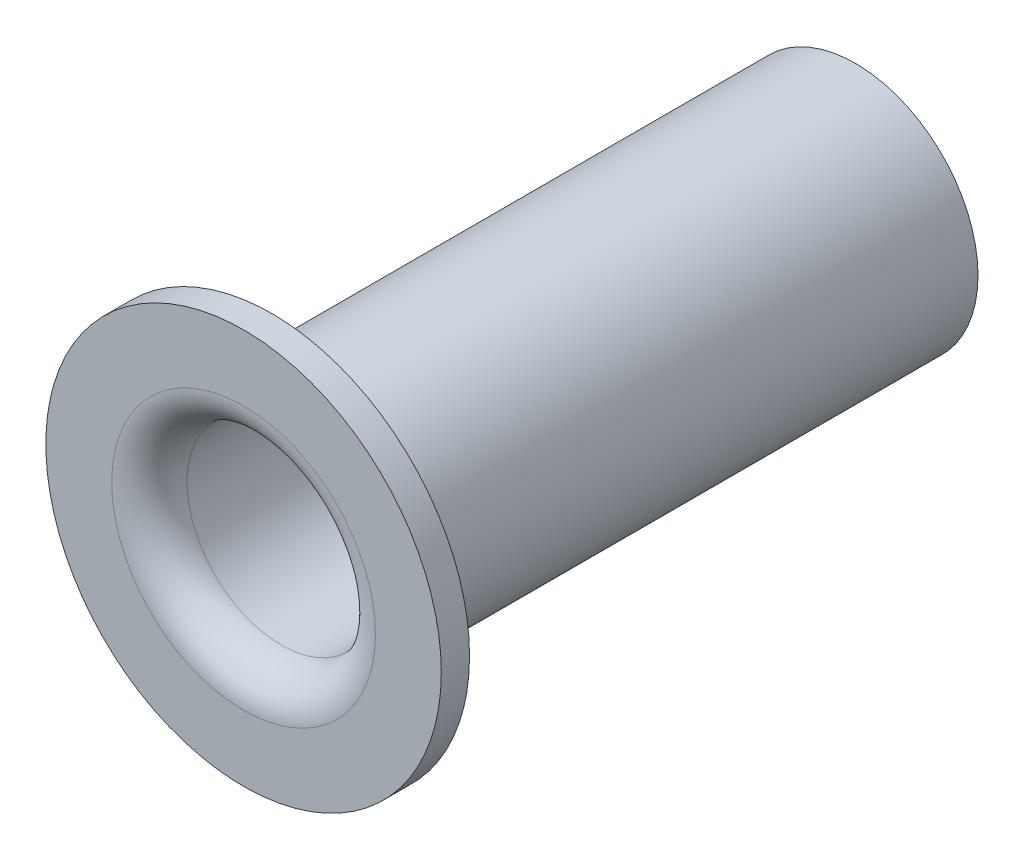
from build123d import *


with BuildPart() as part:
    # Esquisse1 → base (revolve)
    with BuildSketch(Plane(origin=(0, 0, 0), x_dir=(0, 0, -1), z_dir=(1, 0, 0)), mode=Mode.PRIVATE) as base_sk:
        with BuildLine():
            Line((6.2, 1), (6.2, 1.3))
            Line((6.2, 1.3), (0.1, 1.3))
            ThreePointArc((0.1, 1.3), (0.029289322, 1.329289322), (0, 1.4))
            Line((0, 1.4), (0, 2.1))
            Line((0, 2.1), (-0.3, 2.1))
            Line((-0.3, 2.1), (-0.3, 1.4))
            ThreePointArc((-0.3, 1.4), (-0.182842712, 1.117157288), (0.1, 1))
            Line((0.1, 1), (6.2, 1))
        make_face()
    revolve(base_sk.sketch.rotate(Axis((0, 0, 0.3), (0, 0, -1)), 90), axis=Axis((0, 0, 0.3), (0, 0, -1)))


solid = part.part
